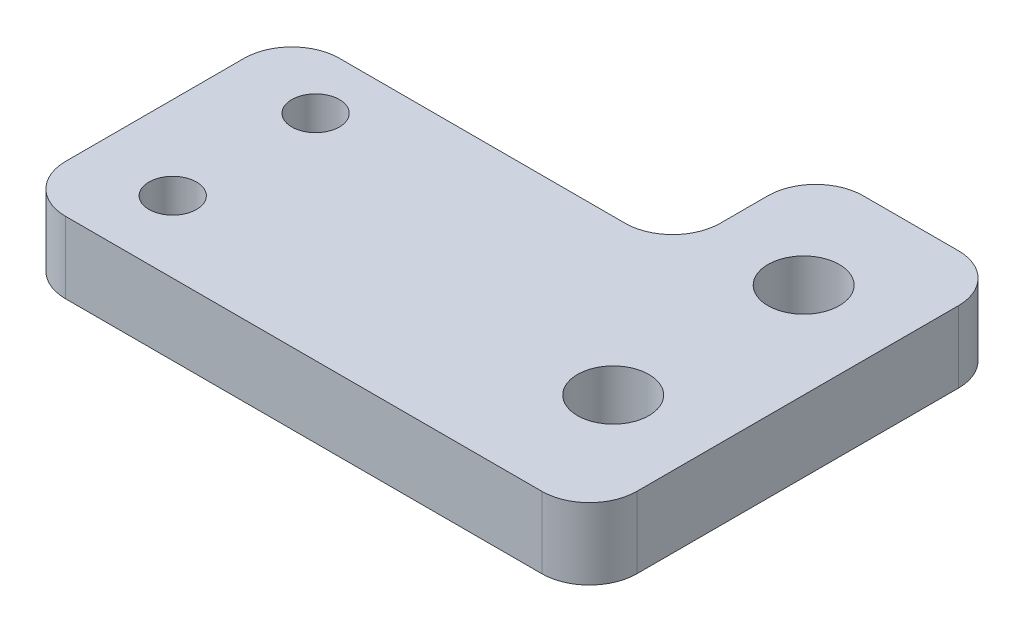
from build123d import *

# Parameters (mm, degrees)
SKETCH_1_R          = 1
SKETCH_1_R_2        = 1.5
EXTRUDE_1_DEPTH     = 3
SKETCH_2_W          = 8
SKETCH_2_H          = 0.5
CUT_EXTRUDE_1_DEPTH = 10
FILLET_1_R          = 2


with BuildPart() as part:
    # 草图1 → 凸台-拉伸1 (new body)
    with BuildSketch(Plane(origin=(0, 0, 0), x_dir=(1, 0, 0), z_dir=(0, 1, 0))):
        Polygon((-17.5, 2.5), (-17.5, -9), (17.5, -9), (17.5, 9), (-1.5, 9), (-1.5, 2.5), align=None)
        with Locations(Location((-14, -6, 0), (0, 0, 270))):
            Circle(SKETCH_1_R, mode=Mode.SUBTRACT)
        with Locations(Location((2.5, -4, 0), (0, 0, 270))):
            Circle(SKETCH_1_R_2, mode=Mode.SUBTRACT)
        with Locations(Location((-14, 0, 0), (0, 0, 270))):
            Circle(SKETCH_1_R, mode=Mode.SUBTRACT)
        with Locations(Location((2.5, 4, 0), (0, 0, 270))):
            Circle(SKETCH_1_R_2, mode=Mode.SUBTRACT)
    extrude(amount=EXTRUDE_1_DEPTH)

    # 草图2 → 切除-拉伸1 (cut)
    with BuildSketch(Plane(origin=(0, 3, 0), x_dir=(1, 0, 0), z_dir=(0, 1, 0))):
        with Locations((2.5, 8.75)):
            Rectangle(SKETCH_2_W, SKETCH_2_H)
        Polygon((17.5, -9), (17.5, 9), (6.5, 9), (6.5, 8.5), (6.5, -9), align=None)
    extrude(amount=-CUT_EXTRUDE_1_DEPTH, mode=Mode.SUBTRACT)

    # 圆角1
    fillet_1_edges = [part.edges().sort_by_distance(p)[0] for p in [
        (-17.5, 1.5, 9),
        (-17.5, 1.5, -2.5),
        (-1.5, 1.5, -2.5),
        (-1.5, 1.5, -8.5),
        (6.5, 1.5, 9),
        (6.5, 1.5, -8.5),
    ]]
    fillet(fillet_1_edges, radius=FILLET_1_R)


solid = part.part
